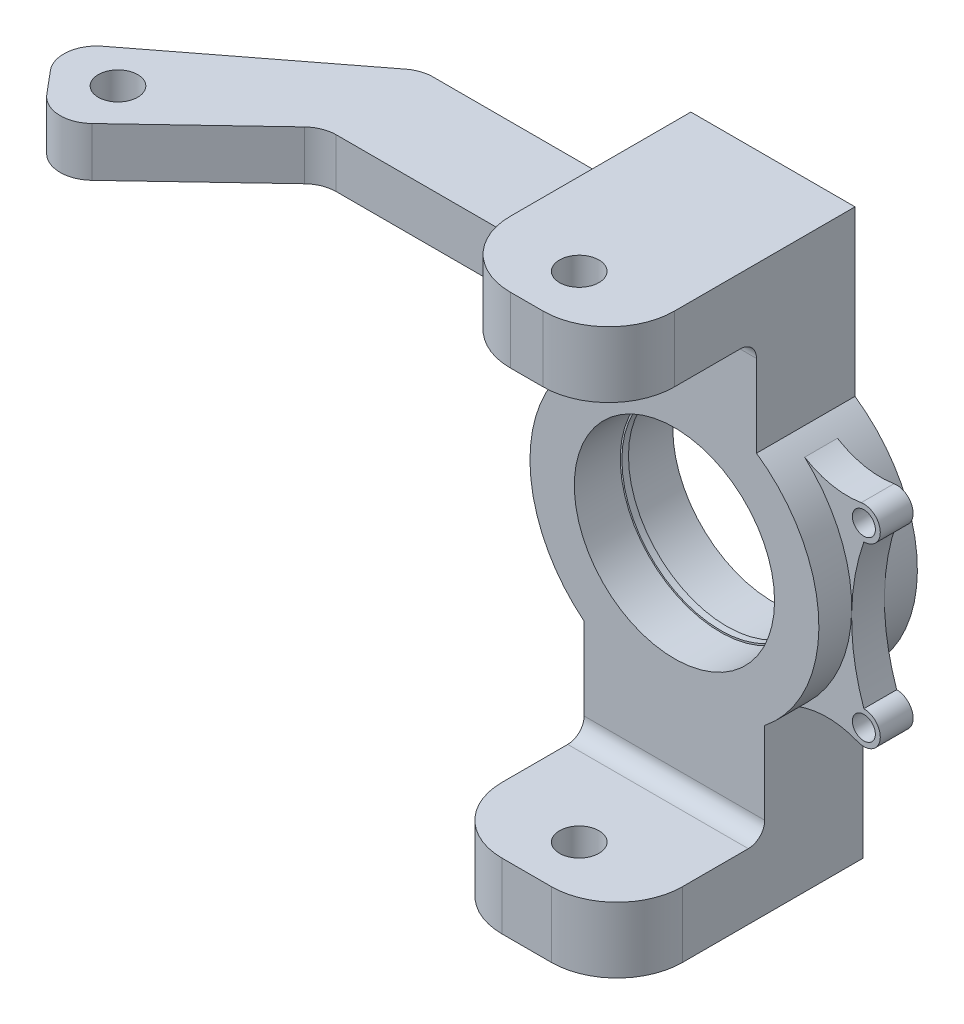
from build123d import *
from build123d.topology import SkipClean

# Parameters (mm, degrees)
BOSS_EXTRUDE1_DEPTH = 30
BOSS_EXTRUDE2_DEPTH = 55
BOSS_EXTRUDE3_DEPTH = 50
SKETCH7_R           = 6
CUT_EXTRUDE4_DEPTH  = 174.861655244
SKETCH9_R           = 6
CUT_EXTRUDE6_DEPTH  = 50
BOSS_EXTRUDE4_DEPTH = 57
BOSS_EXTRUDE5_DEPTH = 15
CUT_EXTRUDE8_DEPTH  = 20
SKETCH14_R          = 6
CUT_EXTRUDE9_DEPTH  = 20
SKETCH29_R          = 30
CUT_EXTRUDE10_DEPTH = 177.381705753
SKETCH31_R          = 30.5
CUT_EXTRUDE11_DEPTH = 14
CUT_EXTRUDE12_START = -14
SKETCH32_R          = 30.5
CUT_EXTRUDE12_DEPTH = 14
BOSS_EXTRUDE6_START = -30
SKETCH33_R          = 5
SKETCH33_R_2        = 3.5
BOSS_EXTRUDE6_DEPTH = 30
CUT_EXTRUDE13_START = -10
SKETCH34_R          = 3.5
CUT_EXTRUDE13_DEPTH = 10
SKETCH35_R          = 3.5
CUT_EXTRUDE14_DEPTH = 10


with BuildPart() as part:
    # Sketch1 → Boss-Extrude1 (new body)
    with BuildSketch(Plane.XY):
        with BuildLine():
            Line((-25, 86.20773398), (-25, 36.20773398))
            ThreePointArc((-25, 36.20773398), (-43.972404666, 1.558084675), (-27.5, -34.347488991))
            Line((-27.5, -34.347488991), (-27.5, -84.347488991))
            Line((-27.5, -84.347488991), (27.5, -84.347488991))
            Line((27.5, -84.347488991), (27.5, -34.347488991))
            ThreePointArc((27.5, -34.347488991), (43.972404666, 1.558084675), (25, 36.20773398))
            Line((25, 36.20773398), (25, 86.20773398))
            Line((25, 86.20773398), (-25, 86.20773398))
        make_face()
    extrude(amount=BOSS_EXTRUDE1_DEPTH)

    # Sketch3 → Boss-Extrude2 (add)
    with BuildSketch(Plane.ZY.offset(27.5)):
        with BuildLine():
            Line((30, -59.347488991), (30, -84.347488991))
            Line((30, -84.347488991), (55, -84.347488991))
            Line((55, -84.347488991), (75, -84.347488991))
            Line((75, -84.347488991), (75, -79.347488991))
            Line((75, -79.347488991), (75, -69.347488991))
            Line((75, -69.347488991), (75, -64.347488991))
            Line((75, -64.347488991), (55, -64.347488991))
            Line((55, -64.347488991), (35, -64.347488991))
            ThreePointArc((35, -64.347488991), (31.464466094, -62.883022897), (30, -59.347488991))
        make_face()
    extrude(amount=-BOSS_EXTRUDE2_DEPTH)

    # Sketch5 → Boss-Extrude3 (add)
    with BuildSketch(Plane.ZY.offset(25)):
        with BuildLine():
            Line((30, 86.20773398), (55, 86.20773398))
            Line((55, 86.20773398), (75, 86.20773398))
            Line((75, 86.20773398), (75, 81.20773398))
            Line((75, 81.20773398), (75, 71.20773398))
            Line((75, 71.20773398), (75, 66.20773398))
            Line((75, 66.20773398), (70, 66.20773398))
            Line((70, 66.20773398), (35, 66.20773398))
            ThreePointArc((35, 66.20773398), (31.464466094, 64.743267886), (30, 61.20773398))
            Line((30, 61.20773398), (30, 36.20773398))
            Line((30, 36.20773398), (0, 36.20773398))
            Line((0, 36.20773398), (0, 86.20773398))
            Line((0, 86.20773398), (30, 86.20773398))
        make_face()
    extrude(amount=-BOSS_EXTRUDE3_DEPTH)

    # Sketch7 → Cut-Extrude4 (cut, through all)
    with BuildSketch(Plane(origin=(0, -64.347488991, 0), x_dir=(1, 0, 0), z_dir=(0, 1, 0))):
        with BuildLine():
            Line((-27.5, -75), (-7.5, -75))
            ThreePointArc((-7.5, -75), (-21.642135624, -69.142135624), (-27.5, -55))
            Line((-27.5, -55), (-27.5, -75))
        make_face()
        with BuildLine():
            ThreePointArc((27.5, -55), (21.642135624, -69.142135624), (7.5, -75))
            Line((7.5, -75), (27.5, -75))
            Line((27.5, -75), (27.5, -55))
        make_face()
        with Locations(Location((0, -59, 0), (0, 0, 270))):
            Circle(SKETCH7_R)
    extrude(amount=-CUT_EXTRUDE4_DEPTH, mode=Mode.SUBTRACT)

    # Sketch9 → Cut-Extrude6 (cut)
    with BuildSketch(Plane(origin=(0, 86.20773398, 0), x_dir=(1, 0, 0), z_dir=(0, 1, 0))):
        with Locations(Location((0, -59, 0), (0, 0, 270))):
            Circle(SKETCH9_R)
        with BuildLine():
            ThreePointArc((-5, -75), (-19.142135624, -69.142135624), (-25, -55))
            Line((-25, -55), (-25, -75))
            Line((-25, -75), (-5, -75))
        make_face()
        with BuildLine():
            Line((25, -75), (25, -55))
            ThreePointArc((25, -55), (19.142135624, -69.142135624), (5, -75))
            Line((5, -75), (25, -75))
        make_face()
    extrude(amount=-CUT_EXTRUDE6_DEPTH, mode=Mode.SUBTRACT)

    # 3DSketch1 → Boss-Extrude4 (add)
    with BuildSketch(Plane(origin=(-25, 66.20773398, 55), x_dir=(0, 0.44721359549995654, -0.8944271909999166), z_dir=(-1, 0, 0))):
        Polygon((0, 0), (6.708203932, -13.416407865), (33.541019662, 0), (26.83281573, 13.416407865), align=None)
    extrude(amount=BOSS_EXTRUDE4_DEPTH)

    # Sketch11 → Boss-Extrude5 (add)
    with BuildSketch(Plane(origin=(0, 81.20773398, 0), x_dir=(1, 0, 0), z_dir=(0, 1, 0))):
        with BuildLine():
            Line((-82, -25), (-136.931437168, -67.210861168))
            ThreePointArc((-136.931437168, -67.210861168), (-140.779268652, -74.054950012), (-138.498773239, -81.568051896))
            Line((-138.498773239, -81.568051896), (-132.747448798, -88.42221346))
            ThreePointArc((-132.747448798, -88.42221346), (-125.661757565, -91.977806638), (-118.214838183, -89.258862946))
            Line((-118.214838183, -89.258862946), (-84.891653571, -57.735474417))
            ThreePointArc((-84.891653571, -57.735474417), (-81.717780519, -55.709002857), (-78.019487387, -55))
            Line((-78.019487387, -55), (-82, -55))
            Line((-82, -55), (-82, -25))
        make_face()
    extrude(amount=-BOSS_EXTRUDE5_DEPTH)

    # Sketch13 → Cut-Extrude8 (cut)
    with BuildSketch(Plane(origin=(0, 81.20773398, 0), x_dir=(1, 0, 0), z_dir=(0, 1, 0))):
        with BuildLine():
            Line((-82, -25), (-84.69470274, -27.070685369))
            ThreePointArc((-84.69470274, -27.070685369), (-81.819268516, -25.531812573), (-78.60159438, -25))
            Line((-78.60159438, -25), (-82, -25))
        make_face()
    extrude(amount=-CUT_EXTRUDE8_DEPTH, mode=Mode.SUBTRACT)

    # Sketch14 → Cut-Extrude9 (cut)
    with BuildSketch(Plane(origin=(0, 81.20773398, 0), x_dir=(1, 0, 0), z_dir=(0, 1, 0))):
        with Locations(Location((-124.132444372, -75.353318533, 0), (0, 0, 270))):
            Circle(SKETCH14_R)
    extrude(amount=-CUT_EXTRUDE9_DEPTH, mode=Mode.SUBTRACT)

    # Sketch29 → Cut-Extrude10 (cut, through all)
    with BuildSketch(Plane.XY.offset(30)):
        Circle(SKETCH29_R)
    extrude(amount=-CUT_EXTRUDE10_DEPTH, mode=Mode.SUBTRACT)

    # Sketch31 → Cut-Extrude11 (cut)
    with BuildSketch(Plane.XY.offset(30)):
        Circle(SKETCH31_R)
    extrude(amount=-CUT_EXTRUDE11_DEPTH, mode=Mode.SUBTRACT)

    # Sketch32 → Cut-Extrude12 (cut)
    with BuildSketch(Plane(origin=(0, 0, 0), x_dir=(-1, 0, 0), z_dir=(0, 0, -1)).offset(CUT_EXTRUDE12_START)):
        with Locations(Location((0, 0, 0), (0, 0, 180))):
            Circle(SKETCH32_R)
    extrude(amount=CUT_EXTRUDE12_DEPTH, mode=Mode.SUBTRACT)

    # Sketch33 → Boss-Extrude6 (add)
    # profile 1 of 4: a face of its own
    with BuildSketch(Plane.XY.offset(30).offset(BOSS_EXTRUDE6_START)):
        with BuildLine():
            ThreePointArc((29.668581995, 32.492695216), (40.481284897, 17.241391274), (43.98567695, -1.122596647))
            ThreePointArc((43.98567695, -1.122596647), (45.052408179, 9.172001814), (47.700347933, 19.177254836))
            ThreePointArc((47.700347933, 19.177254836), (42.717236075, 23.76665015), (46.881912301, 29.109816353))
            ThreePointArc((46.881912301, 29.109816353), (37.968784011, 29.241858766), (29.668581995, 32.492695216))
        make_face()
    # profile 2 of 4: a face of its own
    with BuildSketch(Plane.XY.offset(30).offset(BOSS_EXTRUDE6_START)):
        with BuildLine():
            ThreePointArc((43.98567695, -1.122596647), (39.414767157, -19.556996956), (27.5, -34.347488991))
            ThreePointArc((27.5, -34.347488991), (36.679636907, -32.663078699), (45.837380536, -34.462718491))
            ThreePointArc((45.837380536, -34.462718491), (42.791179641, -28.874026722), (47.700347933, -24.822745164))
            ThreePointArc((47.700347933, -24.822745164), (44.767717102, -13.1412086), (43.98567695, -1.122596647))
        make_face()
    # profile 3 of 4: a face of its own
    with BuildSketch(Plane.XY.offset(30).offset(BOSS_EXTRUDE6_START)):
        with Locations((47.700347933, 24.177254836)):
            Circle(SKETCH33_R)
        with Locations((47.700347933, 24.177254836)):
            Circle(SKETCH33_R_2, mode=Mode.SUBTRACT)
    # profile 4 of 4: a face of its own
    with BuildSketch(Plane.XY.offset(30).offset(BOSS_EXTRUDE6_START)):
        with Locations((47.700347933, -29.822745164)):
            Circle(SKETCH33_R)
        with Locations((47.700347933, -29.822745164)):
            Circle(SKETCH33_R_2, mode=Mode.SUBTRACT)
    extrude(amount=BOSS_EXTRUDE6_DEPTH)

    # Sketch34 → Cut-Extrude13 (cut)
    # profile 1 of 4: a face of its own
    with SkipClean():  # the faces are left unmerged after this step: merging them gives an invalid solid
        with BuildSketch(Plane.XY.offset(30).offset(CUT_EXTRUDE13_START)):
            with BuildLine():
                ThreePointArc((47.700347933, 19.177254836), (42.717236075, 23.76665015), (46.881912301, 29.109816353))
                ThreePointArc((46.881912301, 29.109816353), (37.968784011, 29.241858766), (29.668581995, 32.492695216))
                ThreePointArc((29.668581995, 32.492695216), (40.481285017, 17.241390992), (43.985676935, -1.122597259))
                ThreePointArc((43.985676935, -1.122597259), (45.052408124, 9.172001513), (47.700347933, 19.177254836))
            make_face()
        # profile 2 of 4: a face of its own
        with BuildSketch(Plane.XY.offset(30).offset(CUT_EXTRUDE13_START)):
            with BuildLine():
                ThreePointArc((47.700347933, 19.177254836), (51.235881839, 20.64172093), (52.700347933, 24.177254836))
                ThreePointArc((52.700347933, 24.177254836), (50.933598762, 27.99118838), (46.881912301, 29.109816353))
                ThreePointArc((46.881912301, 29.109816353), (42.717236075, 23.76665015), (47.700347933, 19.177254836))
            make_face()
            with Locations((47.700347933, 24.177254836)):
                Circle(SKETCH34_R, mode=Mode.SUBTRACT)
        # profile 3 of 4: a face of its own
        with BuildSketch(Plane.XY.offset(30).offset(CUT_EXTRUDE13_START)):
            with BuildLine():
                ThreePointArc((47.700347933, -24.822745164), (44.767717149, -13.141208903), (43.985676935, -1.122597259))
                ThreePointArc((43.985676935, -1.122597259), (39.414767021, -19.55699723), (27.5, -34.347488991))
                ThreePointArc((27.5, -34.347488991), (36.679636907, -32.663078699), (45.837380536, -34.462718491))
                ThreePointArc((45.837380536, -34.462718491), (42.791179641, -28.874026722), (47.700347933, -24.822745164))
            make_face()
        # profile 4 of 4: a face of its own
        with BuildSketch(Plane.XY.offset(30).offset(CUT_EXTRUDE13_START)):
            with BuildLine():
                ThreePointArc((52.700347933, -29.822745164), (51.235881839, -26.287211258), (47.700347933, -24.822745164))
                ThreePointArc((47.700347933, -24.822745164), (42.791179641, -28.874026722), (45.837380536, -34.462718491))
                ThreePointArc((45.837380536, -34.462718491), (50.500808879, -33.964896597), (52.700347933, -29.822745164))
            make_face()
            with Locations((47.700347933, -29.822745164)):
                Circle(SKETCH34_R, mode=Mode.SUBTRACT)
        extrude(amount=CUT_EXTRUDE13_DEPTH, mode=Mode.SUBTRACT)

    # Sketch35 → Cut-Extrude14 (cut)
    # profile 1 of 4: a face of its own
    with SkipClean():  # the faces are left unmerged after this step: merging them gives an invalid solid
        with BuildSketch(Plane(origin=(0, 0, 0), x_dir=(-1, 0, 0), z_dir=(0, 0, -1))):
            with BuildLine():
                ThreePointArc((-43.985676947, -1.122596764), (-40.48128492, 17.24139122), (-29.668581995, 32.492695216))
                ThreePointArc((-29.668581995, 32.492695216), (-37.968784011, 29.241858766), (-46.881912301, 29.109816353))
                ThreePointArc((-46.881912301, 29.109816353), (-43.886414389, 27.410505665), (-42.700347933, 24.177254836))
                ThreePointArc((-42.700347933, 24.177254836), (-44.164814027, 20.64172093), (-47.700347933, 19.177254836))
                ThreePointArc((-47.700347933, 19.177254836), (-45.052408168, 9.172001756), (-43.985676947, -1.122596764))
            make_face()
        # profile 2 of 4: a face of its own
        with BuildSketch(Plane(origin=(0, 0, 0), x_dir=(-1, 0, 0), z_dir=(0, 0, -1))):
            with BuildLine():
                ThreePointArc((-42.700347933, 24.177254836), (-43.886414389, 27.410505665), (-46.881912301, 29.109816353))
                ThreePointArc((-46.881912301, 29.109816353), (-52.683459792, 24.587859522), (-47.700347933, 19.177254836))
                ThreePointArc((-47.700347933, 19.177254836), (-44.164814027, 20.64172093), (-42.700347933, 24.177254836))
            make_face()
            with Locations(Location((-47.700347933, 24.177254836, 0), (0, 0, 180))):
                Circle(SKETCH35_R, mode=Mode.SUBTRACT)
        # profile 3 of 4: a face of its own
        with BuildSketch(Plane(origin=(0, 0, 0), x_dir=(-1, 0, 0), z_dir=(0, 0, -1))):
            with BuildLine():
                ThreePointArc((-27.5, -34.347488991), (-39.414767131, -19.556997008), (-43.985676947, -1.122596764))
                ThreePointArc((-43.985676947, -1.122596764), (-44.767717111, -13.141208658), (-47.700347933, -24.822745164))
                ThreePointArc((-47.700347933, -24.822745164), (-44.164814027, -26.287211258), (-42.700347933, -29.822745164))
                ThreePointArc((-42.700347933, -29.822745164), (-43.558196501, -32.623206109), (-45.837380536, -34.462718491))
                ThreePointArc((-45.837380536, -34.462718491), (-36.679636907, -32.663078699), (-27.5, -34.347488991))
            make_face()
        # profile 4 of 4: a face of its own
        with BuildSketch(Plane(origin=(0, 0, 0), x_dir=(-1, 0, 0), z_dir=(0, 0, -1))):
            with BuildLine():
                ThreePointArc((-42.700347933, -29.822745164), (-44.164814027, -26.287211258), (-47.700347933, -24.822745164))
                ThreePointArc((-47.700347933, -24.822745164), (-52.609516225, -30.771463606), (-45.837380536, -34.462718491))
                ThreePointArc((-45.837380536, -34.462718491), (-43.558196501, -32.623206109), (-42.700347933, -29.822745164))
            make_face()
            with Locations(Location((-47.700347933, -29.822745164, 0), (0, 0, 180))):
                Circle(SKETCH35_R, mode=Mode.SUBTRACT)
        extrude(amount=-CUT_EXTRUDE14_DEPTH, mode=Mode.SUBTRACT)


solid = part.part
